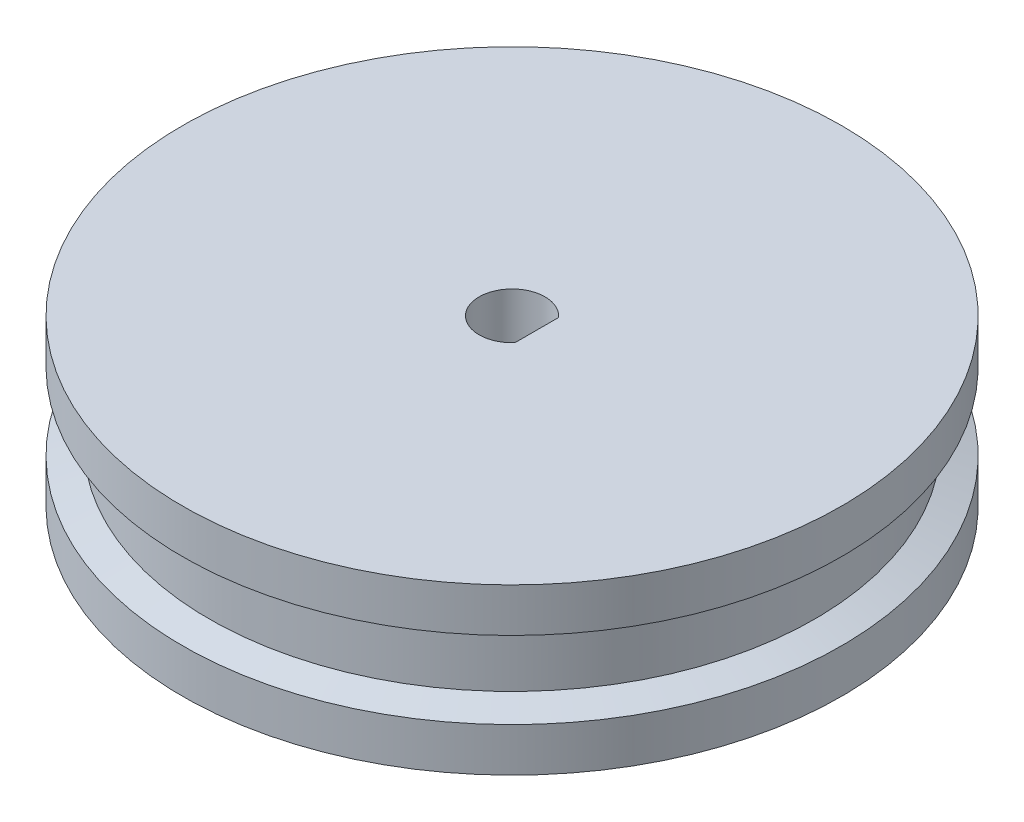
from build123d import *

# Parameters (mm, degrees)
CORTAR_EXTRUIR1_DEPTH = 15


with BuildPart() as part:
    # Croquis1 → Revolución1 (revolve)
    with BuildSketch(Plane(origin=(0, 0, 0), x_dir=(0, 0, -1), z_dir=(1, 0, 0))):
        Polygon((40, 10), (0, 10), (0, -10), (40, -10), (40, -4.682903261), (36.75, -3.5), (36.75, 3.5), (40, 4.682903261), align=None)
    revolve(axis=Axis((0, 0, 0), (0, 1, 0)))

    # Croquis2 → Cortar-Extruir1 (cut, symmetric)
    with BuildSketch(Plane(origin=(0, 0, 0), x_dir=(1, 0, 0), z_dir=(0, 1, 0))):
        with BuildLine():
            Line((3, 2.645751311), (3, -2.645751311))
            ThreePointArc((3, -2.645751311), (-4, 0), (3, 2.645751311))
        make_face()
    extrude(amount=CORTAR_EXTRUIR1_DEPTH, both=True, mode=Mode.SUBTRACT)


solid = part.part
